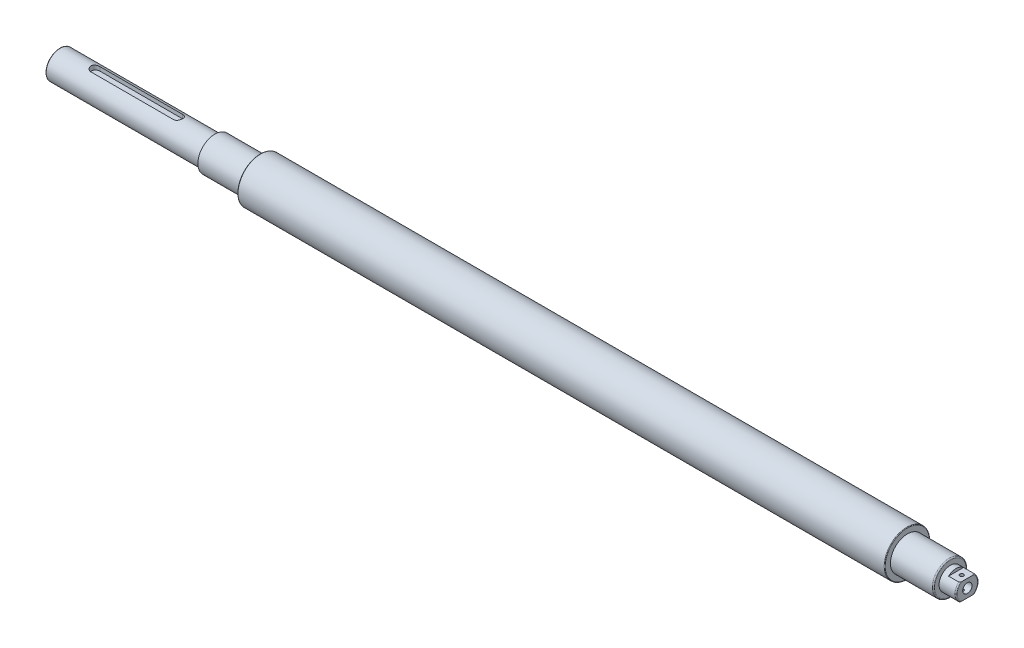
from build123d import *

# Parameters (mm, degrees)
IZIM3_R                     = 10
Y_KSEKLIK_EKSTR_ZYON2_DEPTH = 15
IZIM4_R                     = 4.1
KES_EKSTR_ZYON1_DEPTH       = 15
IZIM5_W                     = 15
IZIM5_H                     = 5
KES_EKSTR_ZYON2_DEPTH       = 10
IZIM6_R                     = 1.65
KES_EKSTR_ZYON3_DEPTH       = 21
RADYUS1_R                   = 1
KES_EKSTR_ZYON4_DEPTH       = 4.1
RADYUS2_R                   = 0.5


with BuildPart() as part:
    # Çizim1 → Döndür1 (revolve)
    with BuildSketch(Plane.XY, mode=Mode.PRIVATE) as d_nd_r1_sk:
        Polygon((0, 0), (787, 0), (787, 15), (749, 15), (749, 20), (177, 20), (177, 15), (137, 15), (137, 12.5), (0, 12.5), align=None)
    revolve(d_nd_r1_sk.sketch.rotate(Axis((0, 0, 0), (1, 0, 0)), 180), axis=Axis((0, 0, 0), (1, 0, 0)))

    # Çizim3 → Yükseklik-Ekstrüzyon2 (add)
    with BuildSketch(Plane(origin=(787, 0, 0), x_dir=(0, 0, -1), z_dir=(1, 0, 0))):
        with Locations(Location((0, 0, 0), (0, 0, 90))):
            Circle(IZIM3_R)
    extrude(amount=Y_KSEKLIK_EKSTR_ZYON2_DEPTH)

    # Çizim4 → Kes-Ekstrüzyon1 (cut)
    with BuildSketch(Plane(origin=(802, 0, 0), x_dir=(0, 0, -1), z_dir=(1, 0, 0))):
        with Locations(Location((0, 0, 0), (0, 0, 90))):
            Circle(IZIM4_R)
    extrude(amount=-KES_EKSTR_ZYON1_DEPTH, mode=Mode.SUBTRACT)

    # Çizim5 → Kes-Ekstrüzyon2 (cut)
    with BuildSketch(Plane(origin=(802, 0, 0), x_dir=(0, 0, -1), z_dir=(1, 0, 0))):
        with Locations((0, 10)):
            Rectangle(IZIM5_W, IZIM5_H)
        with Locations((0, -10)):
            Rectangle(IZIM5_W, IZIM5_H)
    extrude(amount=-KES_EKSTR_ZYON2_DEPTH, mode=Mode.SUBTRACT)

    # Çizim6 → Kes-Ekstrüzyon3 (cut)
    with BuildSketch(Plane(origin=(0, 7.5, 0), x_dir=(1, 0, 0), z_dir=(0, 1, 0))):
        with Locations(Location((797, -0.014378278, 0), (0, 0, 180))):
            Circle(IZIM6_R)
    extrude(amount=-KES_EKSTR_ZYON3_DEPTH, mode=Mode.SUBTRACT)

    # Radyus1
    radyus1_edges = [part.edges().sort_by_distance(p)[0] for p in [
        (787, 15, 0),
        (802, 0, 10),
        (802, 0, -10),
    ]]
    fillet(radyus1_edges, radius=RADYUS1_R)

    # Çizim7 → Kes-Ekstrüzyon4 (cut)
    with BuildSketch(Plane(origin=(0, 12.5, 0), x_dir=(1, 0, 0), z_dir=(0, 1, 0))):
        with BuildLine():
            Line((31.5, 4), (104.5, 4))
            ThreePointArc((104.5, 4), (108.5, 0), (104.5, -4))
            Line((104.5, -4), (31.5, -4))
            ThreePointArc((31.5, -4), (27.5, 0), (31.5, 4))
        make_face()
    extrude(amount=-KES_EKSTR_ZYON4_DEPTH, mode=Mode.SUBTRACT)

    # Radyus2
    radyus2_edges = [part.edges().sort_by_distance(p)[0] for p in [
        (749, 20, 0),
        (0, 12.5, 0),
        (177, 20, 0),
    ]]
    fillet(radyus2_edges, radius=RADYUS2_R)


solid = part.part
